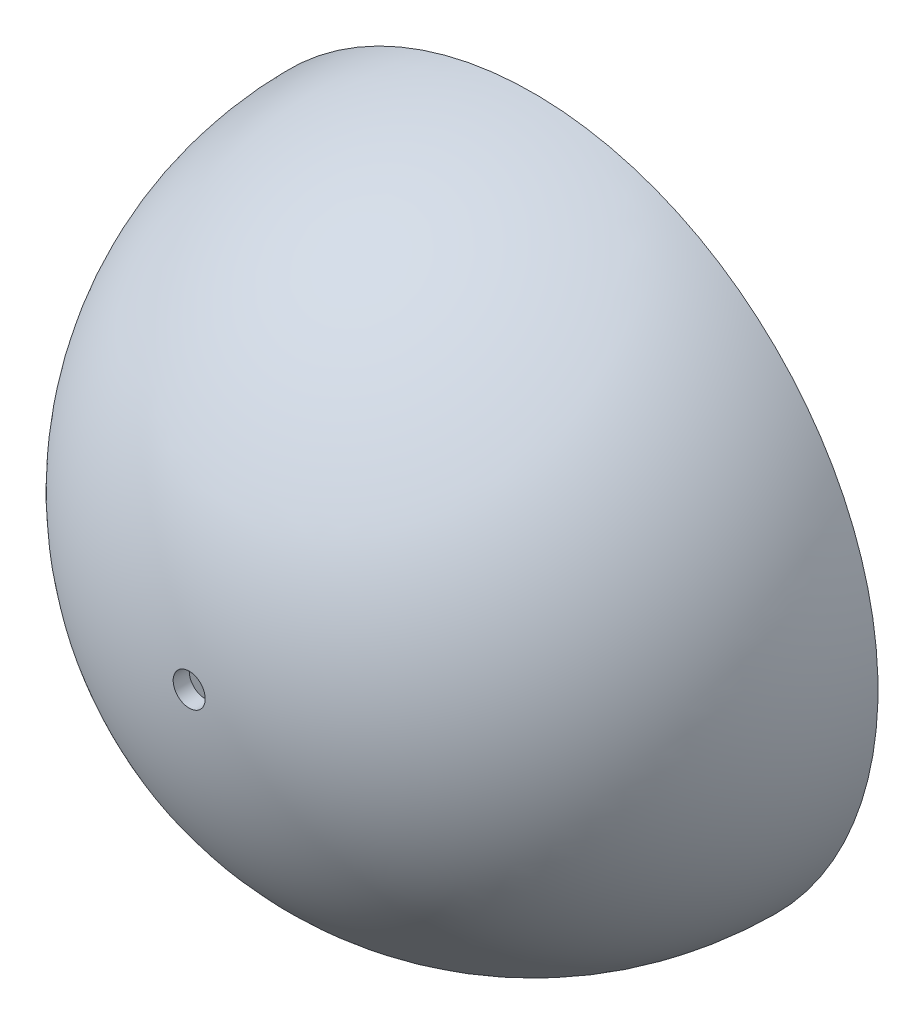
from build123d import *

# Parameters (mm, degrees)
REVOLVE1_ANGLE     = 180
CUT_REVOLVE1_ANGLE = 180
SKETCH3_R          = 10
CUT_EXTRUDE1_DEPTH = 362


with BuildPart() as part:
    # Sketch1 → Revolve1 (revolve)
    with BuildSketch(Plane.XY):
        with BuildLine():
            Line((0, 215), (0, -215))
            ThreePointArc((0, -215), (215, 0), (0, 215))
        make_face()
    revolve(axis=Axis((0, 215, 0), (0, -1, 0)), revolution_arc=REVOLVE1_ANGLE)

    # Sketch2 → Cut-Revolve1 (revolve, cut)
    with BuildSketch(Plane(origin=(0, 0, 0), x_dir=(-1, 0, 0), z_dir=(0, 0, -1))):
        with BuildLine():
            Line((0, 205), (0, -205))
            ThreePointArc((0, -205), (205, 0), (0, 205))
        make_face()
    revolve(axis=Axis((0, 205, 0), (0, 1, 0)), revolution_arc=CUT_REVOLVE1_ANGLE, mode=Mode.SUBTRACT)

    # Sketch3 → Cut-Extrude1 (cut)
    with BuildSketch(Plane.XY):
        with Locations(Location((0, 0, 0), (0, 0, 180))):
            Circle(SKETCH3_R)
    extrude(amount=CUT_EXTRUDE1_DEPTH, mode=Mode.SUBTRACT)


solid = part.part
